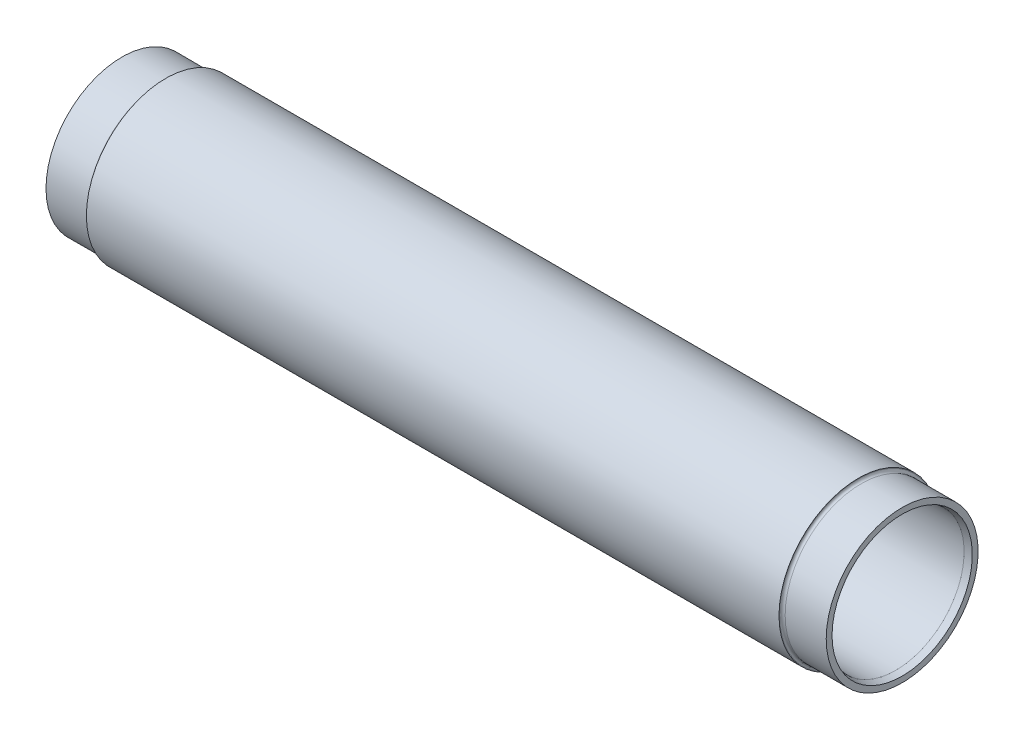
from build123d import *

# Parameters (mm, degrees)
FILLET1_R = 2


with BuildPart() as part:
    # Sketch1 → Revolve1 (revolve)
    with BuildSketch(Plane(origin=(0, 0, 0), x_dir=(1, 0, 0), z_dir=(0, 1, 0)), mode=Mode.PRIVATE) as revolve1_sk:
        Polygon((0, 51.25), (0, 55.5), (32, 55.5), (32, 58), (538, 58), (538, 55.5), (570, 55.5), (570, 51.25), (565.25, 50), (4.75, 50), align=None)
    revolve(revolve1_sk.sketch.rotate(Axis((0, 0, 0), (1, 0, 0)), 180), axis=Axis((0, 0, 0), (1, 0, 0)))

    # Fillet1
    fillet1_edges = [part.edges().sort_by_distance(p)[0] for p in [
        (32, 0, -55.5),
        (538, 0, -55.5),
    ]]
    fillet(fillet1_edges, radius=FILLET1_R)


solid = part.part
